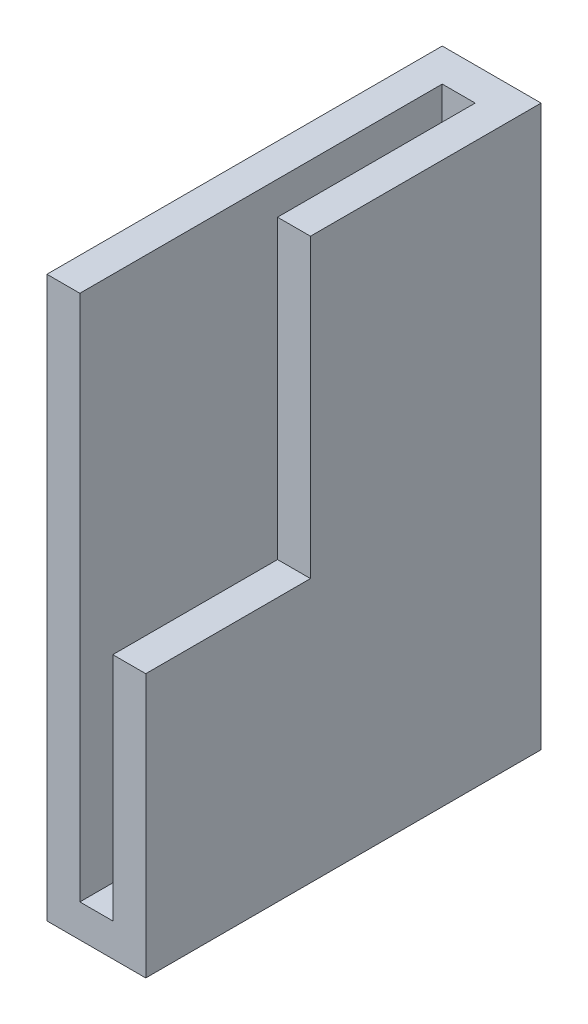
from build123d import *

# Parameters (mm, degrees)
SKETCH1_W           = 12
SKETCH1_H           = 17
BOSS_EXTRUDE1_DEPTH = 3
SKETCH3_W           = 1
SKETCH3_H           = 11
CUT_EXTRUDE1_DEPTH  = 16
CUT_EXTRUDE2_REACH  = 23.024
SKETCH2_W           = 5
SKETCH2_H           = 9


with BuildPart() as part:
    # Sketch1 → Boss-Extrude1 (new body)
    with BuildSketch(Plane(origin=(0, 0, 0), x_dir=(0, 0, -1), z_dir=(1, 0, 0))):
        with Locations((6, -8.5)):
            Rectangle(SKETCH1_W, SKETCH1_H)
    extrude(amount=BOSS_EXTRUDE1_DEPTH)

    # Sketch3 → Cut-Extrude1 (cut)
    with BuildSketch(Plane(origin=(0, 0, 0), x_dir=(1, 0, 0), z_dir=(0, 1, 0))):
        with Locations((1.5, 5.5)):
            Rectangle(SKETCH3_W, SKETCH3_H)
    extrude(amount=-CUT_EXTRUDE1_DEPTH, mode=Mode.SUBTRACT)

    # Sketch2 → Cut-Extrude2 (cut, up to next)
    with BuildSketch(Plane(origin=(3, 0, 0), x_dir=(0, 0, -1), z_dir=(1, 0, 0)), mode=Mode.PRIVATE) as cut_extrude2_sk1:
        with Locations((2.5, -4.5)):
            Rectangle(SKETCH2_W, SKETCH2_H)
    cut_extrude2_tool1 = extrude(cut_extrude2_sk1.sketch, amount=-CUT_EXTRUDE2_REACH, mode=Mode.PRIVATE) & part.part
    add(cut_extrude2_tool1.solids().sort_by_distance((3, -4.5, -2.5))[0], mode=Mode.SUBTRACT)


solid = part.part
